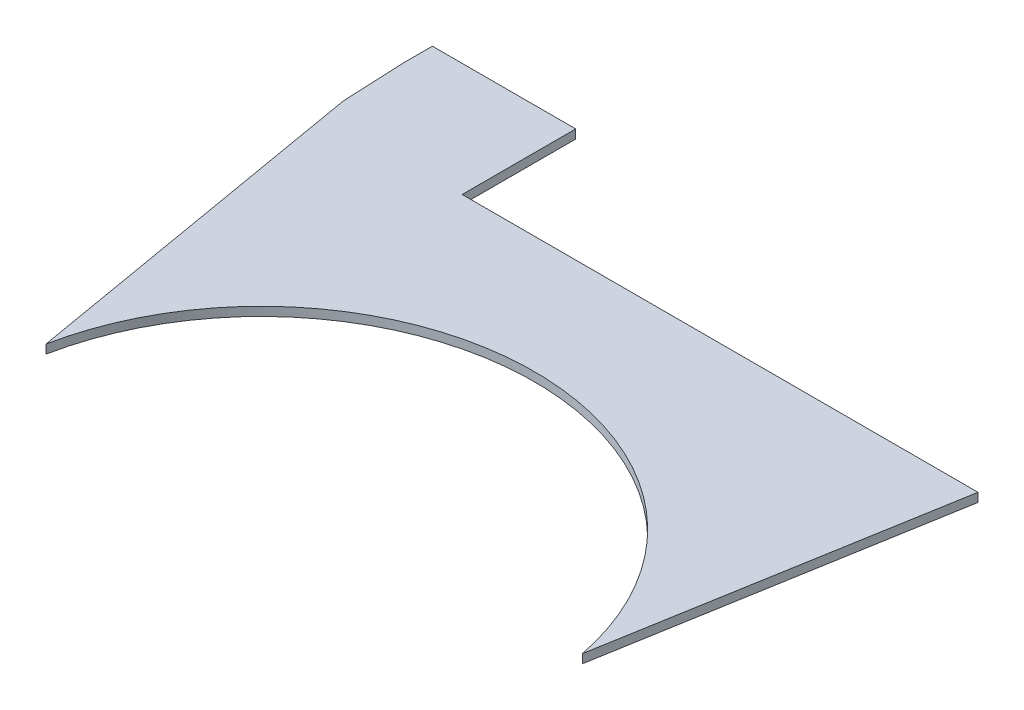
from build123d import *

# Parameters (mm, degrees)
EXTRUDE_1_DEPTH = 1
EXTRUDE_2_DEPTH = 1


with BuildPart() as part:
    # 草图2 → 凸台-拉伸1 (new body)
    with BuildSketch(Plane(origin=(0, 0, 0), x_dir=(1, 0, 0), z_dir=(0, 1, 0))):
        with BuildLine():
            Line((-37.75, -5.187524662), (-37.427791342, -12.336938121))
            Line((-37.427791342, -12.336938121), (-30.410766277, -53.09868086))
            ThreePointArc((-30.410766277, -53.09868086), (0, -28.114102247), (30.410766277, -53.09868086))
            Line((30.410766277, -53.09868086), (36.657098941, -16.813873157))
            Line((36.657098941, -16.813873157), (37.001393596, -14.813873158))
            Line((37.001393596, -14.813873158), (-21.5, -14.813873158))
            Line((-21.5, -14.813873158), (-21.5, -1.937524662))
            Line((-21.5, -1.937524662), (-37.75, -1.937524662))
            Line((-37.75, -1.937524662), (-37.75, -5.187524662))
        make_face()
    extrude(amount=EXTRUDE_1_DEPTH)

    # 草图3 → 凸台-拉伸2 (add)
    # profile 1 of 2: a face of its own
    with BuildSketch(Plane(origin=(0, 0, 0), x_dir=(1, 0, 0), z_dir=(0, 1, 0))):
        with BuildLine():
            Line((-0.856008306, -26.09621982), (-1.623205137, -26.09621982))
            Line((-1.623205137, -26.09621982), (-1.623205137, -24.137821353))
            add(Edge.make_bspline(
                [(-1.623205137, -24.137821353), (-1.655268125, -24.143514077), (-1.721316296, -24.155240806), (-1.824283839, -24.164783502), (-1.933346323, -24.17076586), (-2.008053511, -24.170657837), (-2.046485638, -24.170602266)],
                knots=[0, 0, 0, 0, 0.918585764, 1.892241272, 2.915691322, 4, 4, 4, 4], degree=3))
            add(Edge.make_bspline(
                [(-2.046485638, -24.170602266), (-2.104785366, -24.170571941), (-2.220025321, -24.170511997), (-2.390487029, -24.154509017), (-2.556692953, -24.12850453), (-2.718324735, -24.089526065), (-2.87582336, -24.039158247), (-3.029314168, -23.977977332), (-3.17798521, -23.903769977), (-3.321131503, -23.818737452), (-3.455836859, -23.720606314), (-3.573248856, -23.603221137), (-3.675029776, -23.4704659), (-3.7579419, -23.320396932), (-3.825592093, -23.154649423), (-3.874729538, -22.972446384), (-3.908442208, -22.774352183), (-3.916101546, -22.636664835), (-3.920068751, -22.565348758)],
                knots=[0, 0, 0, 0, 1.003522523, 1.98364375, 2.944869411, 3.898614004, 4.843729631, 5.790462383, 6.741287792, 7.702146141, 8.655643954, 9.602935836, 10.551034771, 11.527201242, 12.5464735, 13.626777097, 14.770773406, 16, 16, 16, 16], degree=3))
            add(Edge.make_bspline(
                [(-3.920068751, -22.565348758), (-3.917621314, -22.509206105), (-3.912856522, -22.399904758), (-3.888966748, -22.241365875), (-3.851887205, -22.092719231), (-3.802758946, -21.953287322), (-3.736987826, -21.824826369), (-3.660822021, -21.704776101), (-3.569736975, -21.595056691), (-3.499181783, -21.53152241), (-3.46371946, -21.499588924)],
                knots=[0, 0, 0, 0, 1.126595518, 2.193312949, 3.209115705, 4.196248007, 5.151139266, 6.097382339, 7.043709754, 8, 8, 8, 8], degree=3))
            add(Edge.make_bspline(
                [(-3.46371946, -21.499588924), (-3.423819299, -21.467392586), (-3.342763644, -21.401986955), (-3.204758648, -21.32105817), (-3.053205789, -21.252406965), (-2.887562725, -21.19534799), (-2.707183639, -21.152151647), (-2.5123955, -21.123211501), (-2.303575344, -21.103250861), (-2.159600384, -21.101683502), (-2.085223363, -21.100873809)],
                knots=[0, 0, 0, 0, 0.838628006, 1.70364077, 2.610636308, 3.559859354, 4.568055018, 5.643200099, 6.782484425, 8, 8, 8, 8], degree=3))
            add(Edge.make_bspline(
                [(-2.085223363, -21.100873809), (-2.022547246, -21.101999243), (-1.900326605, -21.10419388), (-1.722031706, -21.10963235), (-1.553493577, -21.11799829), (-1.394779498, -21.129605553), (-1.245704987, -21.14233845), (-1.106447222, -21.158428618), (-0.977269579, -21.177092329), (-0.894709866, -21.191984217), (-0.855064406, -21.199135354)],
                knots=[0, 0, 0, 0, 1.217605855, 2.374374404, 3.464660226, 4.494999595, 5.465333604, 6.370582827, 7.217548217, 8, 8, 8, 8], degree=3))
            Line((-0.855064406, -21.199135354), (-0.856008306, -26.09621982))
        make_face()
        with BuildLine():
            add(Edge.make_bspline(
                [(-1.623205137, -21.739832201), (-1.65274721, -21.733999838), (-1.719633086, -21.720794849), (-1.833986924, -21.708704947), (-1.973601931, -21.699443395), (-2.075441396, -21.696669118), (-2.130574845, -21.695167191)],
                knots=[0, 0, 0, 0, 0.708180311, 1.603383121, 2.702528978, 4, 4, 4, 4], degree=3))
            add(Edge.make_bspline(
                [(-2.130574845, -21.695167191), (-2.168073561, -21.695952692), (-2.24132842, -21.697487191), (-2.348460101, -21.707705221), (-2.449759776, -21.725860501), (-2.54572877, -21.750031884), (-2.635478405, -21.782226009), (-2.71969003, -21.821293247), (-2.797963445, -21.867371353), (-2.870093205, -21.92060581), (-2.935949572, -21.979929245), (-2.993080877, -22.047665882), (-3.041017981, -22.122592696), (-3.081384443, -22.203868683), (-3.112473184, -22.292435582), (-3.13480904, -22.388111375), (-3.14923784, -22.490598656), (-3.151639324, -22.56120559), (-3.152872842, -22.597472724)],
                knots=[0, 0, 0, 0, 1.164286524, 2.274468469, 3.33712435, 4.356941393, 5.343590938, 6.292901648, 7.23538906, 8.158502959, 9.072142365, 9.981112688, 10.900594105, 11.827687296, 12.792632354, 13.80775062, 14.873954761, 16, 16, 16, 16], degree=3))
            add(Edge.make_bspline(
                [(-3.152872842, -22.597472724), (-3.151613433, -22.636249876), (-3.149167963, -22.711545774), (-3.13519411, -22.82079109), (-3.111174009, -22.922850983), (-3.079419521, -23.018294919), (-3.038824966, -23.107069292), (-2.988156623, -23.188218343), (-2.928144539, -23.262075146), (-2.860007553, -23.329662929), (-2.783057089, -23.388781734), (-2.699594044, -23.441477416), (-2.608012254, -23.4847832), (-2.509562282, -23.520465241), (-2.404100063, -23.54918737), (-2.291122917, -23.56840422), (-2.171164858, -23.580930403), (-2.088720416, -23.582872542), (-2.046485638, -23.583867464)],
                knots=[0, 0, 0, 0, 1.10647952, 2.148516939, 3.135813804, 4.093347323, 5.013956832, 5.913991464, 6.814877829, 7.723438285, 8.645449828, 9.577866136, 10.534345172, 11.529217628, 12.562346088, 13.648092354, 14.795160789, 16, 16, 16, 16], degree=3))
            add(Edge.make_bspline(
                [(-2.046485638, -23.583867464), (-2.00521482, -23.584412899), (-1.926388911, -23.585454662), (-1.814442024, -23.578443617), (-1.714043734, -23.567445346), (-1.652392814, -23.552941286), (-1.623205137, -23.546074562)],
                knots=[0, 0, 0, 0, 1.161518353, 2.218461969, 3.156558288, 4, 4, 4, 4], degree=3))
            Line((-1.623205137, -23.546074562), (-1.623205137, -21.739832201))
        make_face(mode=Mode.SUBTRACT)
    # profile 2 of 2: a face of its own
    with BuildSketch(Plane(origin=(0, 0, 0), x_dir=(1, 0, 0), z_dir=(0, 1, 0))):
        with BuildLine():
            Line((0.130386434, -21.131914551), (0.897583266, -21.131914551))
            Line((0.897583266, -21.131914551), (0.897583266, -24.155636425))
            add(Edge.make_bspline(
                [(0.897583266, -24.155636425), (0.89929321, -24.215445763), (0.902592367, -24.33084157), (0.915368258, -24.497724176), (0.936829282, -24.652102877), (0.966769663, -24.79430293), (1.005239493, -24.924351911), (1.052260261, -25.041802473), (1.107369405, -25.147128319), (1.170551424, -25.240289062), (1.242373791, -25.321087274), (1.319851887, -25.391822873), (1.404784791, -25.450371121), (1.495300915, -25.499626189), (1.593035117, -25.536183316), (1.69708966, -25.5615439), (1.807291946, -25.577012589), (1.882979468, -25.57854654), (1.921769062, -25.579332685)],
                knots=[0, 0, 0, 0, 1.442558911, 2.783265207, 4.033293762, 5.19797452, 6.283894868, 7.299176403, 8.243481286, 9.144954945, 10.005756174, 10.844503658, 11.66816234, 12.486940923, 13.323278702, 14.176003432, 15.065208066, 16, 16, 16, 16], degree=3))
            add(Edge.make_bspline(
                [(1.921769062, -25.579332685), (1.957725333, -25.578915325), (2.028096046, -25.578098501), (2.130909973, -25.562628358), (2.228129718, -25.535898617), (2.320368479, -25.498795392), (2.40757394, -25.451723675), (2.488940384, -25.393059054), (2.564744704, -25.323401018), (2.635860422, -25.243242907), (2.699760366, -25.150387865), (2.755013907, -25.045271413), (2.802850288, -24.927654795), (2.840414423, -24.797263515), (2.872028446, -24.654713055), (2.894014576, -24.499623904), (2.908368244, -24.332115662), (2.910724859, -24.216299952), (2.911943092, -24.156429928)],
                knots=[0, 0, 0, 0, 0.880869997, 1.723967724, 2.54076827, 3.348096003, 4.15667844, 4.964596865, 5.80091263, 6.676282017, 7.586647838, 8.557371955, 9.582678263, 10.694376867, 11.880403812, 13.160330013, 14.532054847, 16, 16, 16, 16], degree=3))
            Line((2.911943092, -24.156429928), (2.911943092, -21.131914551))
            Line((2.911943092, -21.131914551), (3.679139924, -21.131914551))
            Line((3.679139924, -21.131914551), (3.679139924, -24.109921407))
            add(Edge.make_bspline(
                [(3.679139924, -24.109921407), (3.677188401, -24.198867937), (3.673417448, -24.370740501), (3.648553918, -24.618287645), (3.610391814, -24.846397955), (3.557827499, -25.055163342), (3.491261126, -25.245040827), (3.410030292, -25.415512075), (3.31448028, -25.566466666), (3.203498097, -25.697108223), (3.080569907, -25.809550333), (2.94882349, -25.908176054), (2.805519828, -25.989407969), (2.653202823, -26.056947418), (2.49058693, -26.108131021), (2.318208544, -26.142255886), (2.1365007, -26.164139495), (2.011908047, -26.164790111), (1.948224093, -26.165122665)],
                knots=[0, 0, 0, 0, 1.389947096, 2.68581329, 3.884176986, 5.001519278, 6.046082896, 7.023506491, 7.946473535, 8.830015835, 9.69383004, 10.545329235, 11.396344648, 12.262399475, 13.145009074, 14.054291982, 15.00547603, 16, 16, 16, 16], degree=3))
            add(Edge.make_bspline(
                [(1.948224093, -26.165122665), (1.881721214, -26.164339998), (1.751827834, -26.162811293), (1.561981249, -26.141967577), (1.382440978, -26.104865244), (1.212643091, -26.053613752), (1.053287044, -25.984492529), (0.903741738, -25.900795559), (0.764964905, -25.800213917), (0.635145258, -25.685884953), (0.518115943, -25.552843022), (0.4164162, -25.399939828), (0.330633136, -25.227687461), (0.260185761, -25.036841598), (0.204398311, -24.827427738), (0.164915765, -24.598798774), (0.137702567, -24.351381444), (0.133499992, -24.179812722), (0.131330334, -24.091237172)],
                knots=[0, 0, 0, 0, 1.013962662, 1.980471211, 2.907472823, 3.806985122, 4.680561309, 5.551651082, 6.415505808, 7.289926821, 8.185106327, 9.109702809, 10.082849364, 11.113391155, 12.207519227, 13.383461846, 14.649163417, 16, 16, 16, 16], degree=3))
            Line((0.131330334, -24.091237172), (0.130386434, -21.131914551))
        make_face()
    extrude(amount=-EXTRUDE_2_DEPTH)


solid = part.part
